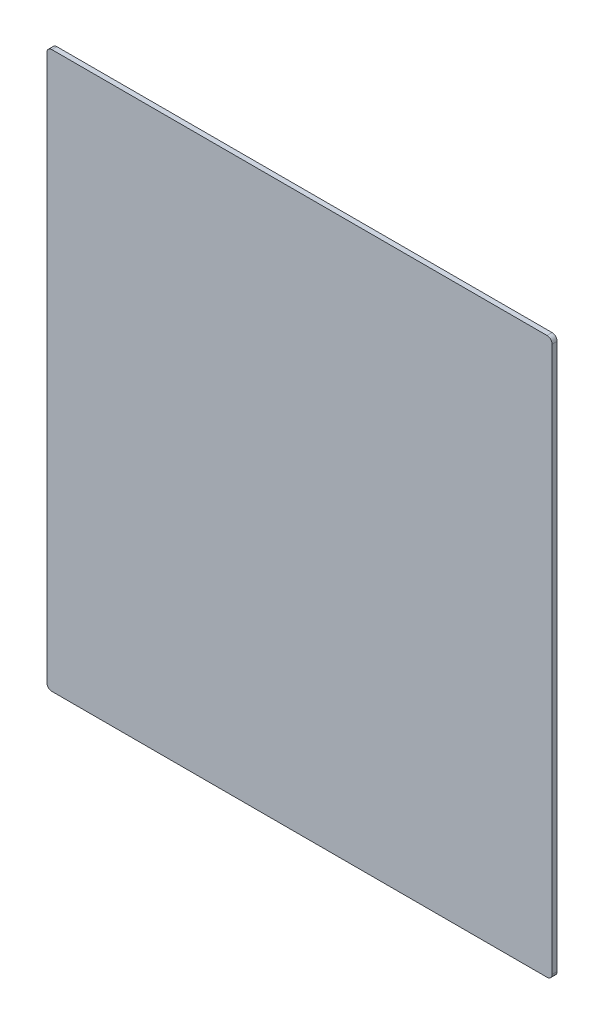
from build123d import *

# Parameters (mm, degrees)
SKETCH_1_W          = 300
SKETCH_1_H          = 330
EXTRUDE_1_DEPTH     = 3
SKETCH_4_R          = 1
CUT_EXTRUDE_3_DEPTH = 1
FILLET_1_R          = 3


with BuildPart() as part:
    # 草图1 → 凸台-拉伸1 (new body)
    with BuildSketch(Plane.XY):
        with Locations((150, 165)):
            Rectangle(SKETCH_1_W, SKETCH_1_H)
    extrude(amount=EXTRUDE_1_DEPTH)

    # 草图4 → 切除-拉伸3 (cut)
    with BuildSketch(Plane(origin=(0, 0, 0), x_dir=(-1, 0, 0), z_dir=(0, 0, -1))):
        with Locations((-270, 300)):
            Circle(SKETCH_4_R)
        with Locations((-240, 300)):
            Circle(SKETCH_4_R)
        with Locations((-210, 300)):
            Circle(SKETCH_4_R)
        with Locations((-180, 300)):
            Circle(SKETCH_4_R)
        with Locations((-150, 300)):
            Circle(SKETCH_4_R)
        with Locations((-120, 300)):
            Circle(SKETCH_4_R)
        with Locations((-90, 300)):
            Circle(SKETCH_4_R)
        with Locations((-60, 300)):
            Circle(SKETCH_4_R)
        with Locations((-30, 300)):
            Circle(SKETCH_4_R)
        with Locations((-240, 270)):
            Circle(SKETCH_4_R)
        with Locations((-210, 270)):
            Circle(SKETCH_4_R)
        with Locations((-180, 270)):
            Circle(SKETCH_4_R)
        with Locations((-150, 270)):
            Circle(SKETCH_4_R)
        with Locations((-120, 270)):
            Circle(SKETCH_4_R)
        with Locations((-90, 270)):
            Circle(SKETCH_4_R)
        with Locations((-60, 270)):
            Circle(SKETCH_4_R)
        with Locations((-30, 270)):
            Circle(SKETCH_4_R)
        with Locations((-240, 240)):
            Circle(SKETCH_4_R)
        with Locations((-210, 240)):
            Circle(SKETCH_4_R)
        with Locations((-180, 240)):
            Circle(SKETCH_4_R)
        with Locations((-150, 240)):
            Circle(SKETCH_4_R)
        with Locations((-120, 240)):
            Circle(SKETCH_4_R)
        with Locations((-90, 240)):
            Circle(SKETCH_4_R)
        with Locations((-60, 240)):
            Circle(SKETCH_4_R)
        with Locations((-30, 240)):
            Circle(SKETCH_4_R)
        with Locations((-240, 210)):
            Circle(SKETCH_4_R)
        with Locations((-210, 210)):
            Circle(SKETCH_4_R)
        with Locations((-180, 210)):
            Circle(SKETCH_4_R)
        with Locations((-150, 210)):
            Circle(SKETCH_4_R)
        with Locations((-120, 210)):
            Circle(SKETCH_4_R)
        with Locations((-90, 210)):
            Circle(SKETCH_4_R)
        with Locations((-60, 210)):
            Circle(SKETCH_4_R)
        with Locations((-30, 210)):
            Circle(SKETCH_4_R)
        with Locations((-240, 180)):
            Circle(SKETCH_4_R)
        with Locations((-210, 180)):
            Circle(SKETCH_4_R)
        with Locations((-180, 180)):
            Circle(SKETCH_4_R)
        with Locations((-150, 180)):
            Circle(SKETCH_4_R)
        with Locations((-120, 180)):
            Circle(SKETCH_4_R)
        with Locations((-90, 180)):
            Circle(SKETCH_4_R)
        with Locations((-60, 180)):
            Circle(SKETCH_4_R)
        with Locations((-30, 180)):
            Circle(SKETCH_4_R)
        with Locations((-240, 150)):
            Circle(SKETCH_4_R)
        with Locations((-210, 150)):
            Circle(SKETCH_4_R)
        with Locations((-180, 150)):
            Circle(SKETCH_4_R)
        with Locations((-150, 150)):
            Circle(SKETCH_4_R)
        with Locations((-120, 150)):
            Circle(SKETCH_4_R)
        with Locations((-90, 150)):
            Circle(SKETCH_4_R)
        with Locations((-60, 150)):
            Circle(SKETCH_4_R)
        with Locations((-30, 150)):
            Circle(SKETCH_4_R)
        with Locations((-240, 120)):
            Circle(SKETCH_4_R)
        with Locations((-210, 120)):
            Circle(SKETCH_4_R)
        with Locations((-180, 120)):
            Circle(SKETCH_4_R)
        with Locations((-150, 120)):
            Circle(SKETCH_4_R)
        with Locations((-120, 120)):
            Circle(SKETCH_4_R)
        with Locations((-90, 120)):
            Circle(SKETCH_4_R)
        with Locations((-60, 120)):
            Circle(SKETCH_4_R)
        with Locations((-30, 120)):
            Circle(SKETCH_4_R)
        with Locations((-240, 90)):
            Circle(SKETCH_4_R)
        with Locations((-210, 90)):
            Circle(SKETCH_4_R)
        with Locations((-180, 90)):
            Circle(SKETCH_4_R)
        with Locations((-150, 90)):
            Circle(SKETCH_4_R)
        with Locations((-120, 90)):
            Circle(SKETCH_4_R)
        with Locations((-90, 90)):
            Circle(SKETCH_4_R)
        with Locations((-60, 90)):
            Circle(SKETCH_4_R)
        with Locations((-30, 90)):
            Circle(SKETCH_4_R)
        with Locations((-240, 60)):
            Circle(SKETCH_4_R)
        with Locations((-210, 60)):
            Circle(SKETCH_4_R)
        with Locations((-180, 60)):
            Circle(SKETCH_4_R)
        with Locations((-150, 60)):
            Circle(SKETCH_4_R)
        with Locations((-120, 60)):
            Circle(SKETCH_4_R)
        with Locations((-90, 60)):
            Circle(SKETCH_4_R)
        with Locations((-60, 60)):
            Circle(SKETCH_4_R)
        with Locations((-30, 60)):
            Circle(SKETCH_4_R)
        with Locations((-240, 30)):
            Circle(SKETCH_4_R)
        with Locations((-210, 30)):
            Circle(SKETCH_4_R)
        with Locations((-180, 30)):
            Circle(SKETCH_4_R)
        with Locations((-150, 30)):
            Circle(SKETCH_4_R)
        with Locations((-120, 30)):
            Circle(SKETCH_4_R)
        with Locations((-90, 30)):
            Circle(SKETCH_4_R)
        with Locations((-60, 30)):
            Circle(SKETCH_4_R)
        with Locations((-30, 30)):
            Circle(SKETCH_4_R)
        with Locations((-270, 270)):
            Circle(SKETCH_4_R)
        with Locations((-270, 240)):
            Circle(SKETCH_4_R)
        with Locations((-270, 210)):
            Circle(SKETCH_4_R)
        with Locations((-270, 180)):
            Circle(SKETCH_4_R)
        with Locations((-270, 150)):
            Circle(SKETCH_4_R)
        with Locations((-270, 120)):
            Circle(SKETCH_4_R)
        with Locations((-270, 90)):
            Circle(SKETCH_4_R)
        with Locations((-270, 60)):
            Circle(SKETCH_4_R)
        with Locations((-270, 30)):
            Circle(SKETCH_4_R)
    extrude(amount=-CUT_EXTRUDE_3_DEPTH, mode=Mode.SUBTRACT)

    # 圆角1
    fillet_1_edges = [part.edges().sort_by_distance(p)[0] for p in [
        (0, 330, 1.5),
        (300, 330, 1.5),
        (300, 0, 1.5),
        (0, 0, 1.5),
    ]]
    fillet(fillet_1_edges, radius=FILLET_1_R)


solid = part.part
